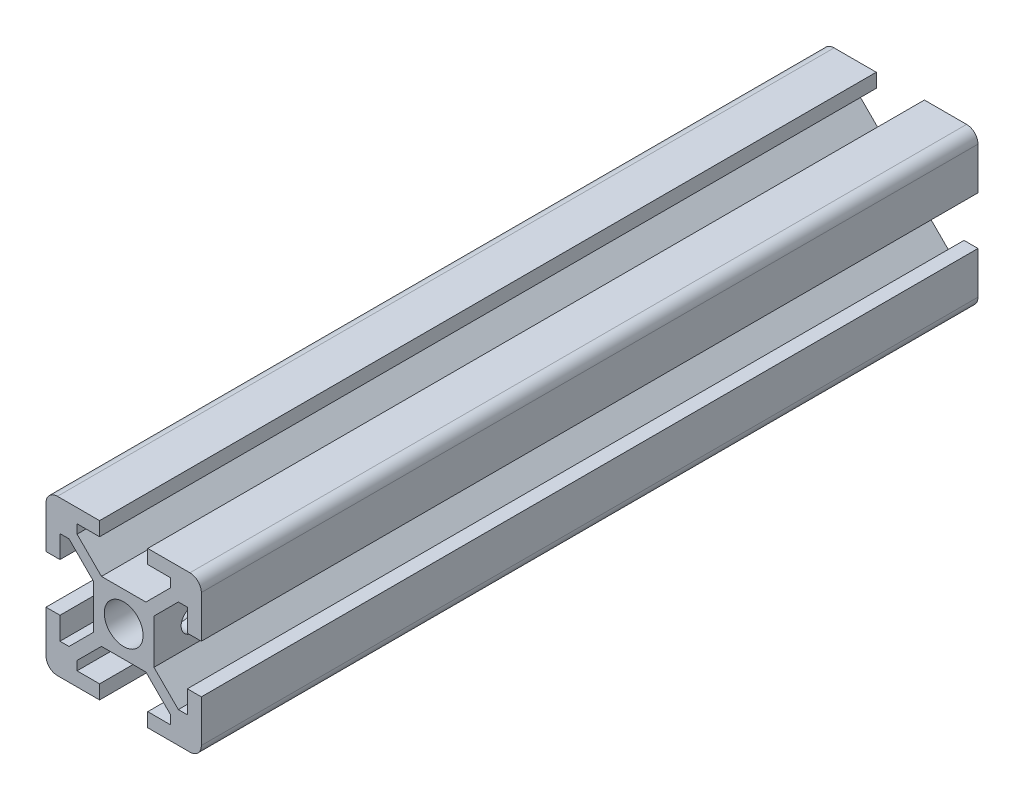
from build123d import *

# Parameters (mm, degrees)
SKETCH1_R           = 2.5
BOSS_EXTRUDE1_DEPTH = 100
FILLET1_R           = 1.47
SKETCH2_R           = 1.5
CUT_EXTRUDE1_DEPTH  = 102.455458207


with BuildPart() as part:
    # Sketch1 → Boss-Extrude1 (new body)
    with BuildSketch(Plane.XY):
        Polygon((2.860553032, 3.9), (6, 7.039446968), (6, 8.2), (3.1, 8.2), (3.1, 10), (10, 10), (10, 3.1), (8.2, 3.1), (8.2, 6), (7.039446968, 6), (3.9, 2.860553032), (3.9, 0), (3.9, -2.860553032), (7.039446968, -6), (8.2, -6), (8.2, -3.1), (10, -3.1), (10, -10), (3.1, -10), (3.1, -8.2), (6, -8.2), (6, -7.039446968), (2.860553032, -3.9), (0, -3.9), (-2.860553032, -3.9), (-6, -7.039446968), (-6, -8.2), (-3.1, -8.2), (-3.1, -10), (-10, -10), (-10, -3.1), (-8.2, -3.1), (-8.2, -6), (-7.039446968, -6), (-3.9, -2.860553032), (-3.9, 0), (-3.9, 2.860553032), (-7.039446968, 6), (-8.2, 6), (-8.2, 3.1), (-10, 3.1), (-10, 10), (-3.1, 10), (-3.1, 8.2), (-6, 8.2), (-6, 7.039446968), (-2.860553032, 3.9), (0, 3.9), align=None)
        Circle(SKETCH1_R, mode=Mode.SUBTRACT)
    extrude(amount=BOSS_EXTRUDE1_DEPTH)

    # Fillet1
    fillet1_edges = [part.edges().sort_by_distance(p)[0] for p in [
        (10, -10, 50),
        (-10, -10, 50),
        (-10, 10, 50),
        (10, 10, 50),
    ]]
    fillet(fillet1_edges, radius=FILLET1_R)

    # Sketch2 → Cut-Extrude1 (cut, through all)
    with BuildSketch(Plane.ZY.offset(3.9)):
        with Locations(Location((95, 0, 0), (0, 0, 270))):
            Circle(SKETCH2_R)
        with Locations(Location((85, 0, 0), (0, 0, 270))):
            Circle(SKETCH2_R)
        with Locations(Location((75, 0, 0), (0, 0, 270))):
            Circle(SKETCH2_R)
        with Locations(Location((65, 0, 0), (0, 0, 270))):
            Circle(SKETCH2_R)
        with Locations(Location((55, 0, 0), (0, 0, 270))):
            Circle(SKETCH2_R)
        with Locations(Location((45, 0, 0), (0, 0, 270))):
            Circle(SKETCH2_R)
        with Locations(Location((35, 0, 0), (0, 0, 270))):
            Circle(SKETCH2_R)
        with Locations(Location((25, 0, 0), (0, 0, 270))):
            Circle(SKETCH2_R)
        with Locations(Location((15, 0, 0), (0, 0, 270))):
            Circle(SKETCH2_R)
        with Locations(Location((5, 0, 0), (0, 0, 270))):
            Circle(SKETCH2_R)
    extrude(amount=-CUT_EXTRUDE1_DEPTH, mode=Mode.SUBTRACT)


solid = part.part
